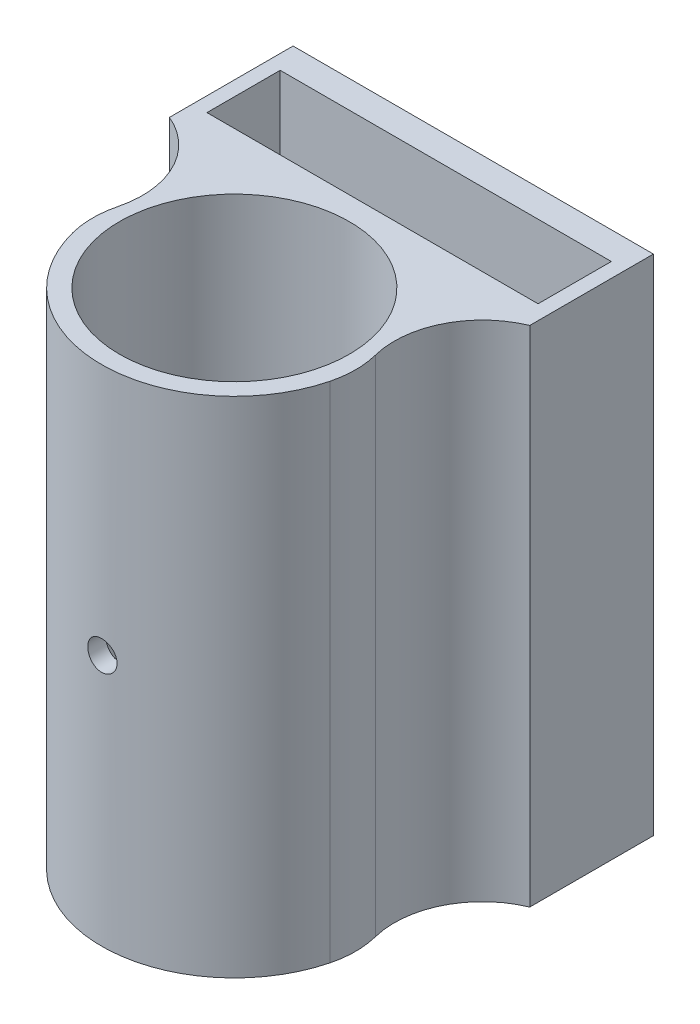
from build123d import *

# Parameters (mm, degrees)
BOSS_EXTRUDE2_DEPTH = 55
SKETCH7_R           = 12.55
CUT_EXTRUDE2_DEPTH  = 64.969298353
SKETCH8_R           = 1.6
CUT_EXTRUDE3_DEPTH  = 72.1238248
SKETCH10_R          = 1.6
CUT_EXTRUDE5_DEPTH  = 8
SKETCH11_W          = 36.155443868
SKETCH11_H          = 8
CUT_EXTRUDE6_DEPTH  = 64.96929848
FILLET1_R           = 10


with BuildPart() as part:
    # Sketch4 → Boss-Extrude2 (new body)
    with BuildSketch(Plane(origin=(0, 0, 0), x_dir=(1, 0, 0), z_dir=(0, 1, 0))):
        with BuildLine():
            Line((-19.671845121, 26.078528358), (19.671845121, 26.078528358))
            Line((19.671845121, 26.078528358), (19.671845121, 12.578528358))
            ThreePointArc((19.671845121, 12.578528358), (14.48082404, 7.360388375), (14.5, 0))
            ThreePointArc((14.5, 0), (0, -14.5), (-14.5, 0))
            ThreePointArc((-14.5, 0), (-14.48082404, 7.360388375), (-19.671845121, 12.578528358))
            Line((-19.671845121, 12.578528358), (-19.671845121, 26.078528358))
        make_face()
    extrude(amount=BOSS_EXTRUDE2_DEPTH)

    # Sketch7 → Cut-Extrude2 (cut, through all)
    with BuildSketch(Plane(origin=(0, 0, 0), x_dir=(1, 0, 0), z_dir=(0, 1, 0))):
        with Locations(Location((0, 0, 0), (0, 0, 270))):
            Circle(SKETCH7_R)
    extrude(amount=CUT_EXTRUDE2_DEPTH, mode=Mode.SUBTRACT)

    # Sketch8 → Cut-Extrude3 (cut, through all)
    with BuildSketch(Plane(origin=(0, 0, -26.078528358), x_dir=(-1, 0, 0), z_dir=(0, 0, -1))):
        with Locations((0, 27.5)):
            Circle(SKETCH8_R)
    extrude(amount=-CUT_EXTRUDE3_DEPTH, mode=Mode.SUBTRACT)

    # Sketch10 → Cut-Extrude5 (cut)
    with BuildSketch(Plane(origin=(0, 0, -26.078528358), x_dir=(-1, 0, 0), z_dir=(0, 0, -1))):
        with Locations((8.838834765, 18.661165235)):
            Circle(SKETCH10_R)
        with Locations((8.838834765, 36.338834765)):
            Circle(SKETCH10_R)
        with Locations((-8.838834765, 36.338834765)):
            Circle(SKETCH10_R)
        with Locations((-8.838834765, 18.661165235)):
            Circle(SKETCH10_R)
    extrude(amount=-CUT_EXTRUDE5_DEPTH, mode=Mode.SUBTRACT)

    # Sketch11 → Cut-Extrude6 (cut, through all)
    with BuildSketch(Plane(origin=(0, 55, 0), x_dir=(1, 0, 0), z_dir=(0, 1, 0))):
        with Locations((0, 19.078528358)):
            Rectangle(SKETCH11_W, SKETCH11_H)
    extrude(amount=-CUT_EXTRUDE6_DEPTH, mode=Mode.SUBTRACT)

    # Fillet1
    fillet1_edges = [part.edges().sort_by_distance(p)[0] for p in [
        (14.5, 27.5, 0),
        (-14.5, 27.5, 0),
    ]]
    fillet(fillet1_edges, radius=FILLET1_R)


solid = part.part
